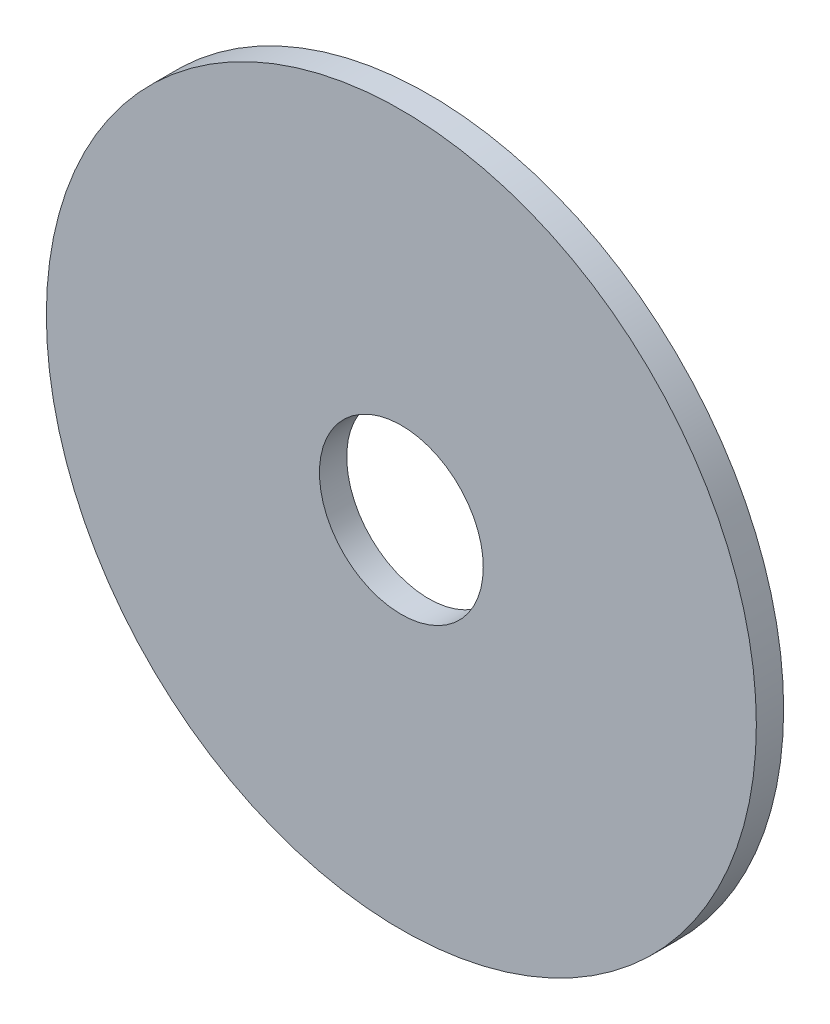
from build123d import *

# Parameters (mm, degrees)
SKETCH_1_R          = 13
EXTRUDE_1_DEPTH     = 1
SKETCH_2_R          = 3
CUT_EXTRUDE_1_DEPTH = 1


with BuildPart() as part:
    # 草图1 → 凸台-拉伸1 (new body)
    with BuildSketch(Plane.XY):
        Circle(SKETCH_1_R)
    extrude(amount=EXTRUDE_1_DEPTH)

    # 草图2 → 切除-拉伸1 (cut)
    with BuildSketch(Plane.XY.offset(1)):
        Circle(SKETCH_2_R)
    extrude(amount=-CUT_EXTRUDE_1_DEPTH, mode=Mode.SUBTRACT)


solid = part.part
